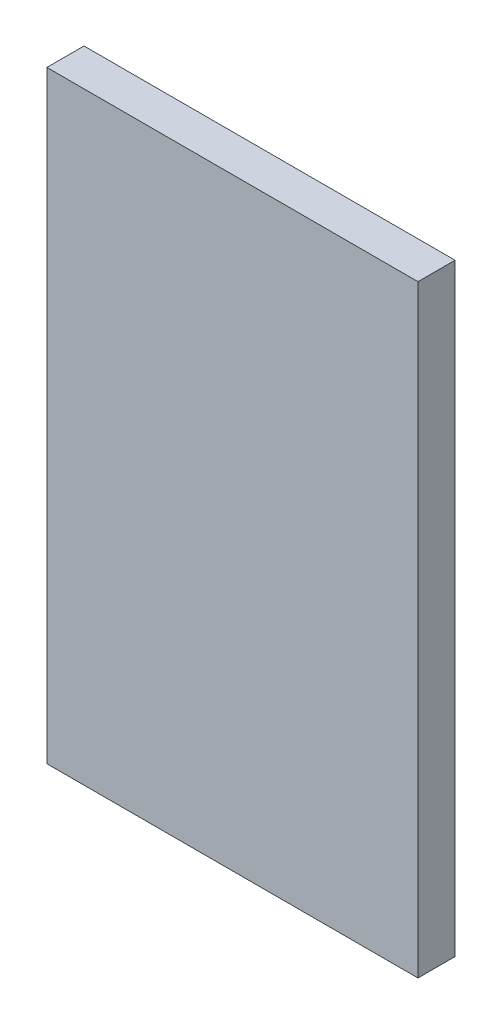
from build123d import *

# Parameters (mm, degrees)
SKETCH1_W           = 40
SKETCH1_H           = 65
BOSS_EXTRUDE1_DEPTH = 4


with BuildPart() as part:
    # Sketch1 → Boss-Extrude1 (new body)
    with BuildSketch(Plane.XY):
        with Locations((20, 32.5)):
            Rectangle(SKETCH1_W, SKETCH1_H)
    extrude(amount=BOSS_EXTRUDE1_DEPTH)


solid = part.part
